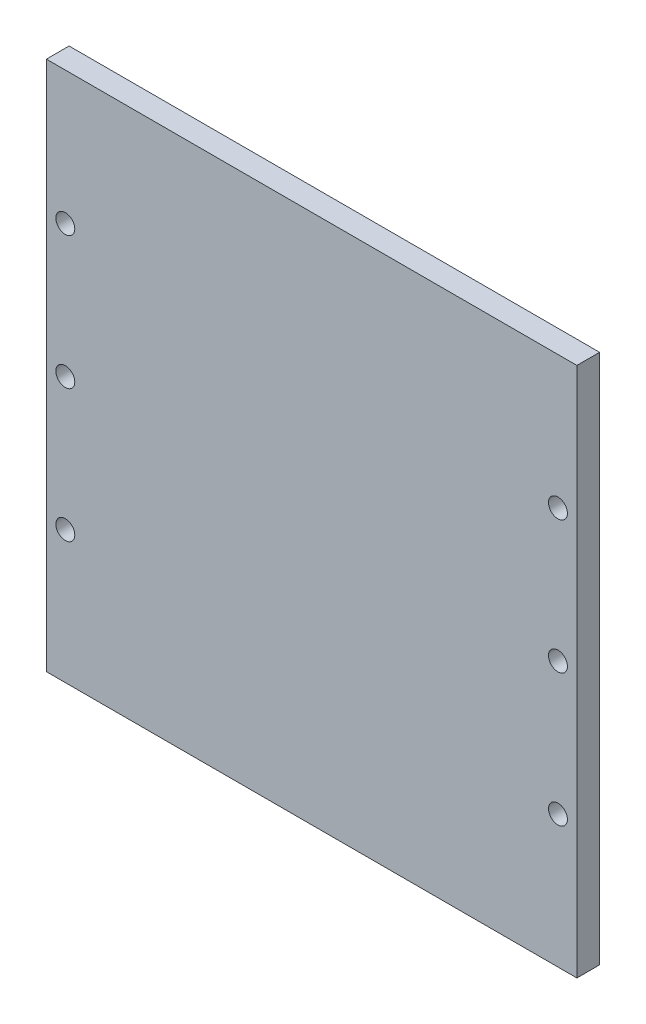
from build123d import *

# Parameters (mm, degrees)
SKETCH1_W           = 71.17
SKETCH1_H           = 71.17
BOSS_EXTRUDE1_DEPTH = 3.048
SKETCH2_R           = 1.27
CUT_EXTRUDE2_DEPTH  = 10


with BuildPart() as part:
    # Sketch1 → Boss-Extrude1 (new body)
    with BuildSketch(Plane.XY):
        Rectangle(SKETCH1_W, SKETCH1_H)
    extrude(amount=BOSS_EXTRUDE1_DEPTH)

    # Sketch2 → Cut-Extrude2 (cut)
    with BuildSketch(Plane.XY.offset(3.048)):
        with Locations((33.045, -17.805)):
            Circle(SKETCH2_R)
        with Locations((33.045, -0.025)):
            Circle(SKETCH2_R)
        with Locations((33.045, 17.755)):
            Circle(SKETCH2_R)
        with Locations((-33.045, -17.805)):
            Circle(SKETCH2_R)
        with Locations((-33.045, -0.025)):
            Circle(SKETCH2_R)
        with Locations((-33.045, 17.755)):
            Circle(SKETCH2_R)
    extrude(amount=-CUT_EXTRUDE2_DEPTH, mode=Mode.SUBTRACT)


solid = part.part
